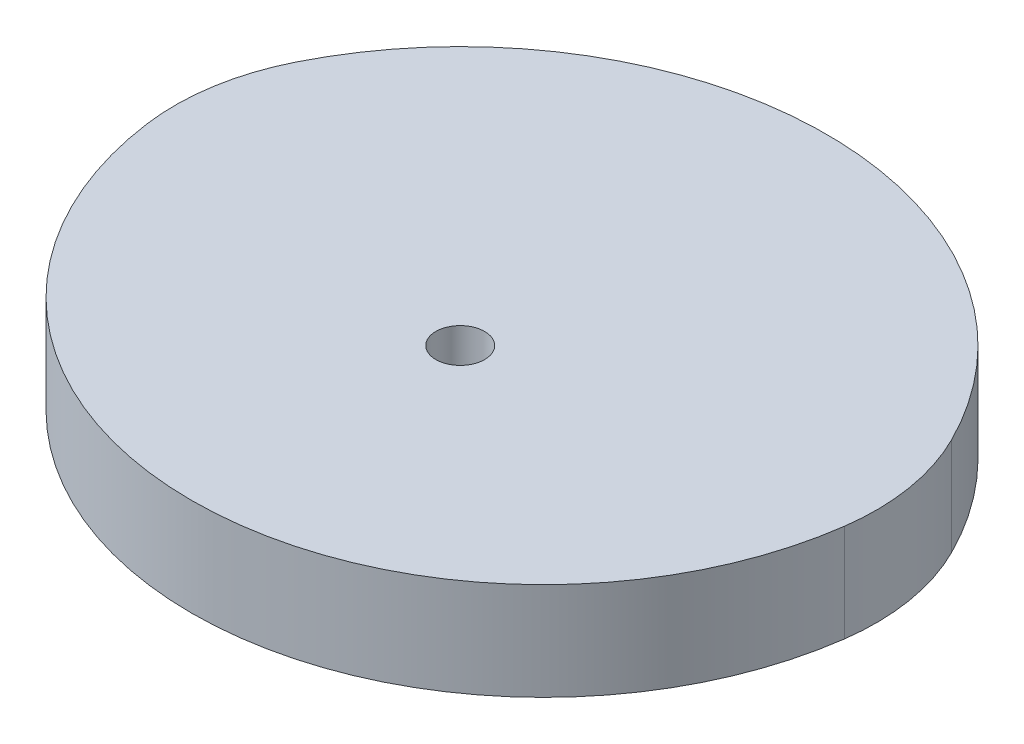
from build123d import *

# Parameters (mm, degrees)
SKETCH_1_R          = 5
EXTRUDE_3_DEPTH     = 20
CUT_EXTRUDE_2_DEPTH = 10


with BuildPart() as part:
    # 草图1 → 凸台-拉伸3 (new body)
    with BuildSketch(Plane(origin=(0, 0, 0), x_dir=(1, 0, 0), z_dir=(0, 1, 0))):
        with BuildLine():
            ThreePointArc((71.418701356, 7.325529194), (71.229458894, 20.760662474), (67.082039325, 33.541019662))
            ThreePointArc((67.082039325, 33.541019662), (0, 75), (-67.082039325, 33.541019662))
            ThreePointArc((-67.082039325, 33.541019662), (-71.229458894, 20.760662474), (-71.418701356, 7.325529194))
            ThreePointArc((-71.418701356, 7.325529194), (0, -55), (71.418701356, 7.325529194))
        make_face()
        Circle(SKETCH_1_R, mode=Mode.SUBTRACT)
    extrude(amount=EXTRUDE_3_DEPTH)

    # 草图1<4> → 切除-拉伸2 (cut)
    with BuildSketch(Plane(origin=(0, 0, 0), x_dir=(1, 0, 0), z_dir=(0, 1, 0))):
        with BuildLine():
            ThreePointArc((66.464714064, 8.002293491), (66.296498543, 19.944634184), (62.60990337, 31.304951685))
            ThreePointArc((62.60990337, 31.304951685), (0, 70), (-62.60990337, 31.304951685))
            ThreePointArc((-62.60990337, 31.304951685), (-66.296498543, 19.944634184), (-66.464714064, 8.002293491))
            ThreePointArc((-66.464714064, 8.002293491), (0, -50), (66.464714064, 8.002293491))
        make_face()
        with BuildLine():
            ThreePointArc((46.648764897, 10.709350678), (0, -30), (-46.648764897, 10.709350678))
            ThreePointArc((-46.648764897, 10.709350678), (-46.564657136, 16.680521024), (-44.72135955, 22.360679775))
            ThreePointArc((-44.72135955, 22.360679775), (0, 50), (44.72135955, 22.360679775))
            ThreePointArc((44.72135955, 22.360679775), (46.564657136, 16.680521024), (46.648764897, 10.709350678))
        make_face(mode=Mode.SUBTRACT)
    extrude(amount=CUT_EXTRUDE_2_DEPTH, mode=Mode.SUBTRACT)


solid = part.part
